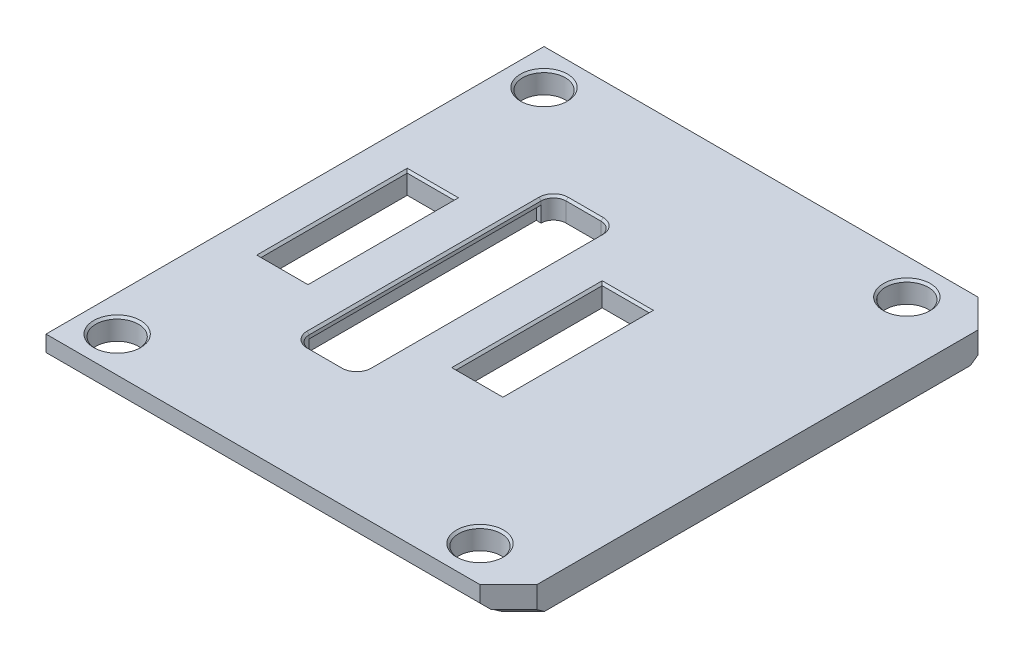
from build123d import *

# Parameters (mm, degrees)
SKETCH21_R          = 3
SKETCH21_W          = 6.6
SKETCH21_H          = 20.55
BOSS_EXTRUDE3_DEPTH = 3
BOSS_EXTRUDE2_DEPTH = 0.8
CUT_EXTRUDE1_DEPTH  = 2.2
CUT_EXTRUDE2_DEPTH  = 1
CHAMFER1_SIZE       = 0.3
CHAMFER2_SIZE       = 0.75


with BuildPart() as part:
    # Sketch21 → Boss-Extrude3 (new body)
    with BuildSketch(Plane(origin=(0, 0, 0), x_dir=(1, 0, 0), z_dir=(0, 1, 0))):
        Polygon((38.5, 35), (-22.5, 35), (-22.5, -35), (38.5, -35), (42.5, -31), (42.5, 31), align=None)
        with Locations((-17.5, 30)):
            Circle(SKETCH21_R, mode=Mode.SUBTRACT)
        with Locations((-17.5, -30)):
            Circle(SKETCH21_R, mode=Mode.SUBTRACT)
        with Locations((33.5, -30)):
            Circle(SKETCH21_R, mode=Mode.SUBTRACT)
        with Locations((33.5, 30)):
            Circle(SKETCH21_R, mode=Mode.SUBTRACT)
        with Locations((-13.7, 0)):
            Rectangle(SKETCH21_W, SKETCH21_H, mode=Mode.SUBTRACT)
        with BuildLine():
            Line((-4.21, 16.3), (-4.21, -16.3))
            ThreePointArc((-4.21, -16.3), (-3.697436867, -17.537436867), (-2.46, -18.05))
            Line((-2.46, -18.05), (2.46, -18.05))
            ThreePointArc((2.46, -18.05), (3.697436867, -17.537436867), (4.21, -16.3))
            Line((4.21, -16.3), (4.21, 16.3))
            ThreePointArc((4.21, 16.3), (3.697436867, 17.537436867), (2.46, 18.05))
            Line((2.46, 18.05), (-2.46, 18.05))
            ThreePointArc((-2.46, 18.05), (-3.697436867, 17.537436867), (-4.21, 16.3))
        make_face(mode=Mode.SUBTRACT)
        with Locations((13.7, 0)):
            Rectangle(SKETCH21_W, SKETCH21_H, mode=Mode.SUBTRACT)
    extrude(amount=BOSS_EXTRUDE3_DEPTH)

    # Sketch28 → Boss-Extrude2 (add)
    with BuildSketch(Plane.XZ):
        Polygon((39.5, 34), (39.5, -34), (42.5, -31), (42.5, 31), align=None)
    extrude(amount=BOSS_EXTRUDE2_DEPTH)

    # Sketch29 → Cut-Extrude1 (cut)
    with BuildSketch(Plane.XZ):
        Polygon((-4.21, 16.3), (-4.875, 16.3), (-4.875, -16.3), (-4.21, -16.3), (4.21, -16.3), (4.875, -16.3), (4.875, 16.3), (4.21, 16.3), align=None)
    extrude(amount=-CUT_EXTRUDE1_DEPTH, mode=Mode.SUBTRACT)

    # Sketch30 → Cut-Extrude2 (cut)
    # profile 1 of 4: a face of its own
    with BuildSketch(Plane.XZ):
        Polygon((30, -5.584415584), (30, -6.623376623), (23.194805195, -6.623376623), (30, -8.858766234), (30, -9.790584416), (23.194805195, -12.025974026), (30, -12.025974026), (30, -13.064935065), (22, -13.064935065), (22, -11.439935065), (28.668831169, -9.329545455), (22, -7.209415584), (22, -5.584415584), align=None)
    # profile 2 of 4: a face of its own
    with BuildSketch(Plane.XZ):
        with BuildLine():
            add(Edge.make_bspline(
                [(30.103896104, -1.798701299), (30.103067309, -1.895623244), (30.101458149, -2.083803562), (30.077120757, -2.356806977), (30.043441513, -2.612684332), (29.990720477, -2.849454628), (29.92681865, -3.069556735), (29.84494459, -3.270560491), (29.751676383, -3.4562646), (29.640184851, -3.621871579), (29.516615752, -3.772075178), (29.375879847, -3.901668661), (29.221972567, -4.015692158), (29.052257996, -4.109156913), (28.868514081, -4.186592109), (28.670085387, -4.243928609), (28.457107647, -4.285605452), (28.309709631, -4.297462408), (28.233766234, -4.303571429)],
                knots=[0, 0, 0, 0, 1.318794478, 2.560526035, 3.728243692, 4.829167506, 5.859211314, 6.844017696, 7.77958115, 8.682536498, 9.55583357, 10.420985288, 11.279874663, 12.156984126, 13.05163966, 13.988564904, 14.963654886, 16, 16, 16, 16], degree=3))
            Line((28.233766234, -4.303571429), (28.233766234, -3.26461039))
            add(Edge.make_bspline(
                [(28.233766234, -3.26461039), (28.276082816, -3.263564761), (28.357947694, -3.261541907), (28.476134337, -3.240166384), (28.586751637, -3.212672627), (28.688349357, -3.17036585), (28.783864525, -3.121500377), (28.868666466, -3.055998852), (28.946860594, -2.982137003), (29.015350514, -2.895594265), (29.078413582, -2.799861025), (29.128391442, -2.689971645), (29.17548457, -2.57144951), (29.209220227, -2.440779669), (29.240159157, -2.300318747), (29.257500765, -2.147495072), (29.271994968, -1.984042329), (29.272478757, -1.871250975), (29.272727273, -1.813311688)],
                knots=[0, 0, 0, 0, 1.000573209, 1.935690443, 2.836843993, 3.693268586, 4.535782358, 5.368499125, 6.220215677, 7.076544447, 7.975601122, 8.926814499, 9.928453325, 10.991382637, 12.117004715, 13.331014315, 14.628980654, 16, 16, 16, 16], degree=3))
            add(Edge.make_bspline(
                [(29.272727273, -1.813311688), (29.272477286, -1.761323175), (29.271992064, -1.660413873), (29.25754424, -1.51369465), (29.239472891, -1.376258483), (29.21132631, -1.248275466), (29.176555316, -1.130075024), (29.131923796, -1.021611339), (29.080501402, -0.922166793), (29.001941506, -0.806296479), (28.891278773, -0.682718379), (28.73659228, -0.572587187), (28.562614518, -0.50468464), (28.440535545, -0.497283039), (28.378246753, -0.493506494)],
                knots=[0, 0, 0, 0, 1.049722362, 2.037502948, 2.975957546, 3.848689641, 4.682196446, 5.461765277, 6.214820971, 6.939488855, 8.285974658, 9.541612251, 10.745648019, 12, 12, 12, 12], degree=3))
            add(Edge.make_bspline(
                [(28.378246753, -0.493506494), (28.346763417, -0.494183282), (28.285509435, -0.495500043), (28.198094752, -0.513038493), (28.116989153, -0.536078954), (28.043895516, -0.573277175), (27.978132386, -0.620152847), (27.91781187, -0.675968403), (27.867975971, -0.743948686), (27.822461309, -0.822779364), (27.783044583, -0.918968765), (27.736245211, -1.032239323), (27.690729471, -1.168941517), (27.640192756, -1.326342557), (27.586743359, -1.505529733), (27.52981461, -1.706135721), (27.472099938, -1.929578583), (27.410484723, -2.167825675), (27.348547139, -2.408916775), (27.281606559, -2.638344652), (27.213843382, -2.85068402), (27.144538665, -3.046605107), (27.071027512, -3.224150567), (26.999273376, -3.386230737), (26.921988655, -3.529162978), (26.844897165, -3.658210405), (26.757806858, -3.771639817), (26.655650322, -3.868805026), (26.538272332, -3.949974022), (26.405573224, -4.015399248), (26.259022178, -4.067101625), (26.096859779, -4.104654298), (25.919870357, -4.124614358), (25.797123614, -4.128080852), (25.733766234, -4.12987013)],
                knots=[0, 0, 0, 0, 0.609469888, 1.185784659, 1.72354831, 2.239788445, 2.766795736, 3.28643782, 3.825837257, 4.394650866, 5.047817349, 5.838989728, 6.771546224, 7.840191231, 9.04536596, 10.397473415, 11.883969141, 13.520573579, 15.169980156, 16.710930355, 18.154580726, 19.492276644, 20.739482987, 21.88068629, 22.927624582, 23.888735019, 24.79347993, 25.691627909, 26.611521855, 27.550140283, 28.552530272, 29.619112255, 30.771072804, 32, 32, 32, 32], degree=3))
            add(Edge.make_bspline(
                [(25.733766234, -4.12987013), (25.67520802, -4.127970482), (25.560134212, -4.12423745), (25.391367911, -4.095537471), (25.230466456, -4.050698077), (25.077097455, -3.986528081), (24.932327589, -3.902583067), (24.793763605, -3.802331737), (24.665049855, -3.681655436), (24.543482, -3.546039193), (24.43312437, -3.394260688), (24.339684079, -3.227132066), (24.257615927, -3.049505201), (24.190985373, -2.859321562), (24.141623211, -2.656271887), (24.103560771, -2.442230454), (24.083220864, -2.215216877), (24.079718791, -2.060100694), (24.077922078, -1.980519481)],
                knots=[0, 0, 0, 0, 0.925490325, 1.81869781, 2.698985002, 3.561843198, 4.439506826, 5.339694674, 6.260029024, 7.223537863, 8.216200057, 9.220155366, 10.24621711, 11.306974059, 12.400590692, 13.547020494, 14.741516967, 16, 16, 16, 16], degree=3))
            add(Edge.make_bspline(
                [(24.077922078, -1.980519481), (24.079100785, -1.889033894), (24.081391296, -1.711255453), (24.100967879, -1.45323672), (24.133116756, -1.211952726), (24.17768197, -0.988210503), (24.236413566, -0.781944584), (24.307185153, -0.593035368), (24.392098481, -0.421208329), (24.489260392, -0.266089492), (24.600165531, -0.128414151), (24.72493983, -0.008947344), (24.86185203, 0.094298865), (25.012592849, 0.179129373), (25.17622274, 0.24610088), (25.353001809, 0.293934263), (25.542097394, 0.327525812), (25.673013023, 0.334222491), (25.74025974, 0.337662338)],
                knots=[0, 0, 0, 0, 1.35942475, 2.641688414, 3.842675212, 4.97503988, 6.028837698, 7.026524857, 7.968775207, 8.872346758, 9.741443809, 10.588878301, 11.433254833, 12.283089724, 13.152223979, 14.05361, 15.000208458, 16, 16, 16, 16], degree=3))
            Line((25.74025974, 0.337662338), (25.74025974, -0.701298701))
            add(Edge.make_bspline(
                [(25.74025974, -0.701298701), (25.674721832, -0.708715551), (25.549076856, -0.722934647), (25.375375364, -0.789794963), (25.22801032, -0.891278982), (25.108112126, -1.029254824), (25.017480494, -1.20236831), (24.95378105, -1.408593969), (24.915339674, -1.647931329), (24.911256881, -1.818566714), (24.909090909, -1.909090909)],
                knots=[0, 0, 0, 0, 0.958885329, 1.838312007, 2.683388096, 3.544636038, 4.476874501, 5.512704297, 6.680458674, 8, 8, 8, 8], degree=3))
            add(Edge.make_bspline(
                [(24.909090909, -1.909090909), (24.910895743, -1.990953805), (24.914357274, -2.147960509), (24.950990134, -2.372453696), (25.008423519, -2.575331214), (25.076523787, -2.727354018), (25.141975259, -2.834516311), (25.197828471, -2.902415345), (25.256998255, -2.962751797), (25.325503304, -3.006899846), (25.395422474, -3.046527148), (25.472769579, -3.071306954), (25.554938786, -3.088887883), (25.61190975, -3.090222262), (25.641233766, -3.090909091)],
                knots=[0, 0, 0, 0, 1.898886608, 3.641917703, 5.263913708, 6.781775949, 7.492829293, 8.171637923, 8.820129793, 9.443813489, 10.056392137, 10.680075833, 11.320610447, 12, 12, 12, 12], degree=3))
            add(Edge.make_bspline(
                [(25.641233766, -3.090909091), (25.693601745, -3.088173991), (25.793343993, -3.082964606), (25.932521067, -3.032755637), (26.046460672, -2.946847813), (26.120477608, -2.847186421), (26.16971367, -2.744863761), (26.211505197, -2.642238609), (26.256566207, -2.515362815), (26.304827388, -2.364194696), (26.357408524, -2.188599575), (26.409102043, -1.987553747), (26.469062821, -1.762972788), (26.527292162, -1.519674479), (26.590317686, -1.2725332), (26.656464534, -1.035158817), (26.725715485, -0.814577671), (26.79891335, -0.611735187), (26.873636009, -0.425204125), (26.951004783, -0.255596696), (27.03015641, -0.102152272), (27.113523202, 0.035276924), (27.205414194, 0.157824135), (27.315001132, 0.261070929), (27.438169167, 0.349818461), (27.576625602, 0.423191195), (27.731509238, 0.478381448), (27.901145757, 0.516112898), (28.08529053, 0.541358551), (28.213113542, 0.544058296), (28.279220779, 0.545454545)],
                knots=[0, 0, 0, 0, 0.886876726, 1.689182582, 2.470212093, 3.276978007, 3.770089089, 4.396329915, 5.157818963, 6.055717916, 7.090729244, 8.269771542, 9.580232216, 11.037716353, 12.51750611, 13.910932755, 15.221554488, 16.442288017, 17.571848501, 18.632682187, 19.606715272, 20.501836021, 21.360120455, 22.198499933, 23.047686038, 23.931415603, 24.849906235, 25.830634081, 26.878051879, 28, 28, 28, 28], degree=3))
            add(Edge.make_bspline(
                [(28.279220779, 0.545454545), (28.34371882, 0.543630808), (28.470156379, 0.540055678), (28.655638898, 0.510463378), (28.832279264, 0.459141376), (29.001301578, 0.390285703), (29.160557988, 0.298734214), (29.312612514, 0.189780286), (29.455421384, 0.059180933), (29.587891688, -0.090437305), (29.709455888, -0.255056432), (29.815732766, -0.434994432), (29.904732119, -0.628858396), (29.978152624, -0.836386007), (30.034513409, -1.057599571), (30.074835203, -1.292625486), (30.099493407, -1.541138559), (30.10240589, -1.711522119), (30.103896104, -1.798701299)],
                knots=[0, 0, 0, 0, 0.930697296, 1.824475469, 2.702134557, 3.581182897, 4.452177757, 5.347490549, 6.276448989, 7.239081344, 8.228006388, 9.226020669, 10.250015029, 11.302452558, 12.399371731, 13.540990107, 14.741812496, 16, 16, 16, 16], degree=3))
        make_face()
    # profile 3 of 4: a face of its own
    with BuildSketch(Plane.XZ):
        with BuildLine():
            add(Edge.make_bspline(
                [(25.647727273, 5.178571429), (25.663868926, 5.237404481), (25.69557779, 5.352976864), (25.762492791, 5.516984929), (25.835929277, 5.672140779), (25.923226831, 5.81521402), (26.018845928, 5.950031986), (26.127864162, 6.072742713), (26.247280239, 6.185841594), (26.376872604, 6.28761882), (26.515090001, 6.378286676), (26.659549059, 6.45859736), (26.81114494, 6.524396891), (26.967502898, 6.580747863), (27.130251704, 6.622014072), (27.298222331, 6.653609379), (27.472566559, 6.671258081), (27.590872115, 6.673954721), (27.650974026, 6.675324675)],
                knots=[0, 0, 0, 0, 1.080664403, 2.122870637, 3.135513598, 4.121071696, 5.090243488, 6.062260214, 7.025955744, 8.002884062, 8.979435442, 9.954147163, 10.929236533, 11.906306165, 12.897591187, 13.902432714, 14.934388144, 16, 16, 16, 16], degree=3))
            add(Edge.make_bspline(
                [(27.650974026, 6.675324675), (27.739854939, 6.673405907), (27.914040031, 6.669645585), (28.168383993, 6.632372222), (28.410389853, 6.575012395), (28.639068653, 6.490870724), (28.855708519, 6.385874537), (29.05907064, 6.255790351), (29.249847074, 6.102603889), (29.42507564, 5.926349967), (29.583344894, 5.733286649), (29.72476204, 5.528675355), (29.840884526, 5.310068065), (29.937692278, 5.081523022), (30.012255802, 4.841667341), (30.066187197, 4.590758052), (30.096758443, 4.328136897), (30.101488106, 4.149427376), (30.103896104, 4.058441558)],
                knots=[0, 0, 0, 0, 1.061234395, 2.079762722, 3.064490561, 4.027783754, 4.984830282, 5.935369269, 6.905666123, 7.902249684, 8.898896153, 9.885150834, 10.868604494, 11.850803598, 12.846610963, 13.864831468, 14.91292835, 16, 16, 16, 16], degree=3))
            add(Edge.make_bspline(
                [(30.103896104, 4.058441558), (30.102120341, 3.967449783), (30.09864379, 3.789308073), (30.068592889, 3.528175859), (30.020586594, 3.279884364), (29.952721368, 3.044086446), (29.862379017, 2.822994362), (29.75516052, 2.612920408), (29.62669014, 2.416941052), (29.480317734, 2.234963781), (29.318861636, 2.068833521), (29.140729889, 1.924531884), (28.951634941, 1.798827965), (28.750498448, 1.691806048), (28.535196167, 1.607499779), (28.307020597, 1.545008992), (28.066977572, 1.500037912), (27.902241026, 1.487114062), (27.818181818, 1.480519481)],
                knots=[0, 0, 0, 0, 1.135749397, 2.223545359, 3.276913024, 4.29032888, 5.281452121, 6.254425173, 7.230723357, 8.20144198, 9.166501487, 10.11721784, 11.05787061, 11.997770945, 12.956281165, 13.938150449, 14.947911418, 16, 16, 16, 16], degree=3))
            Line((27.818181818, 1.480519481), (27.818181818, 2.519480519))
            add(Edge.make_bspline(
                [(27.818181818, 2.519480519), (27.866934669, 2.520835885), (27.963143634, 2.523510565), (28.105064693, 2.541513361), (28.241668711, 2.572034218), (28.373112317, 2.616670569), (28.499069526, 2.673408824), (28.620465875, 2.741435382), (28.73407753, 2.824561436), (28.84506768, 2.915325519), (28.944792, 3.020897323), (29.034003892, 3.136442101), (29.106641276, 3.265108353), (29.168814459, 3.402711229), (29.216292352, 3.551970086), (29.247102771, 3.711704313), (29.269926845, 3.881387443), (29.271775916, 3.998293047), (29.272727273, 4.058441558)],
                knots=[0, 0, 0, 0, 0.982384219, 1.938638799, 2.877766169, 3.798479997, 4.73074491, 5.658598904, 6.596649402, 7.564215146, 8.543750727, 9.516464438, 10.498424915, 11.513726023, 12.555216713, 13.645896338, 14.788802012, 16, 16, 16, 16], degree=3))
            add(Edge.make_bspline(
                [(29.272727273, 4.058441558), (29.271636863, 4.116945008), (29.269498994, 4.23164753), (29.24815687, 4.399143646), (29.21226241, 4.557159819), (29.163716623, 4.706530984), (29.10004518, 4.846138452), (29.023692475, 4.977375255), (28.931567821, 5.098397045), (28.826506652, 5.209266545), (28.711259097, 5.31059354), (28.586417318, 5.397889369), (28.453226039, 5.472113523), (28.31198031, 5.531551029), (28.162672232, 5.579291148), (28.005084397, 5.613291253), (27.838695906, 5.63273205), (27.72515911, 5.635136407), (27.667207792, 5.636363636)],
                knots=[0, 0, 0, 0, 1.107013682, 2.170423479, 3.189239045, 4.170707987, 5.137962914, 6.088366183, 7.038935031, 8.00992507, 8.975442867, 9.938784847, 10.887917706, 11.856310932, 12.834621176, 13.851220186, 14.903222337, 16, 16, 16, 16], degree=3))
            add(Edge.make_bspline(
                [(27.667207792, 5.636363636), (27.608148375, 5.635365734), (27.493412764, 5.633427093), (27.326739082, 5.611254972), (27.170529463, 5.578063998), (27.024533613, 5.529978012), (26.887759663, 5.47146586), (26.763378155, 5.395007086), (26.648492661, 5.306948012), (26.544440534, 5.204803721), (26.453539854, 5.088360148), (26.373759138, 4.96098952), (26.304436544, 4.821727597), (26.250060086, 4.668936898), (26.208377006, 4.504094117), (26.177167244, 4.32783609), (26.159766001, 4.138878407), (26.157178483, 4.008692527), (26.155844156, 3.941558442)],
                knots=[0, 0, 0, 0, 1.094523671, 2.126347478, 3.112462429, 4.051770496, 4.972837835, 5.864293945, 6.751447308, 7.652621225, 8.560030944, 9.48437223, 10.435769975, 11.438843206, 12.48539564, 13.585791557, 14.755044136, 16, 16, 16, 16], degree=3))
            Line((26.155844156, 3.941558442), (26.155844156, 3.558441558))
            Line((26.155844156, 3.558441558), (25.324675325, 3.558441558))
            Line((25.324675325, 3.558441558), (25.324675325, 3.784090909))
            add(Edge.make_bspline(
                [(25.324675325, 3.784090909), (25.323981736, 3.842041052), (25.322636957, 3.954398948), (25.305370906, 4.117560066), (25.280812359, 4.269895069), (25.242946936, 4.411154572), (25.194905289, 4.540750961), (25.135489264, 4.65900637), (25.067703214, 4.767179103), (24.987470673, 4.863807736), (24.89592461, 4.948341697), (24.794320442, 5.022443365), (24.681641532, 5.083833355), (24.558696063, 5.134574994), (24.424753455, 5.173482763), (24.280011907, 5.199863333), (24.125511196, 5.219134389), (24.019004063, 5.220220981), (23.964285714, 5.220779221)],
                knots=[0, 0, 0, 0, 1.224683085, 2.374503454, 3.465438828, 4.483957385, 5.46148884, 6.382482867, 7.277528178, 8.154997256, 9.029327969, 9.905826849, 10.807066319, 11.735562612, 12.713094066, 13.749764922, 14.84393519, 16, 16, 16, 16], degree=3))
            add(Edge.make_bspline(
                [(23.964285714, 5.220779221), (23.915519624, 5.220125134), (23.820942567, 5.218856598), (23.683886842, 5.201030767), (23.555242862, 5.178255703), (23.4353673, 5.142312275), (23.325248056, 5.094335192), (23.221497555, 5.040211096), (23.128774024, 4.972224668), (23.043551507, 4.896265006), (22.969760877, 4.809634867), (22.902851442, 4.716778724), (22.850561986, 4.612967625), (22.803798169, 4.502916159), (22.77110931, 4.383065774), (22.743949408, 4.25592629), (22.730135556, 4.119893558), (22.728240078, 4.02653921), (22.727272727, 3.978896104)],
                knots=[0, 0, 0, 0, 1.171660605, 2.27232101, 3.318572352, 4.31058758, 5.272450672, 6.203912609, 7.117482204, 8.029475319, 8.942581526, 9.848615055, 10.773968381, 11.730802205, 12.719141549, 13.755148827, 14.854347071, 16, 16, 16, 16], degree=3))
            add(Edge.make_bspline(
                [(22.727272727, 3.978896104), (22.728169319, 3.929618155), (22.729917405, 3.833540939), (22.744555482, 3.694002328), (22.769087414, 3.5626543), (22.802515691, 3.439615316), (22.846726417, 3.324919729), (22.900385422, 3.218712089), (22.964121486, 3.120809885), (23.036962256, 3.030843605), (23.121502148, 2.951065235), (23.213464033, 2.877330272), (23.317032583, 2.814189325), (23.429525822, 2.758849084), (23.55183696, 2.711828354), (23.683818649, 2.673238614), (23.82524868, 2.641647554), (23.92356413, 2.629573704), (23.974025974, 2.623376623)],
                knots=[0, 0, 0, 0, 1.146609889, 2.235545268, 3.260562954, 4.253516318, 5.198347118, 6.116360883, 7.017549724, 7.912469503, 8.803126044, 9.717678205, 10.650770472, 11.619470255, 12.632113028, 13.6960019, 14.817439237, 16, 16, 16, 16], degree=3))
            Line((23.974025974, 2.623376623), (23.974025974, 1.584415584))
            add(Edge.make_bspline(
                [(23.974025974, 1.584415584), (23.891536316, 1.595491761), (23.730820825, 1.617071596), (23.49908682, 1.671599586), (23.28182109, 1.740680654), (23.080104832, 1.828456116), (22.89367264, 1.933054673), (22.721638858, 2.053585402), (22.565393924, 2.192468558), (22.424444691, 2.346784403), (22.298928011, 2.514014638), (22.192377977, 2.693287602), (22.101003684, 2.880575148), (22.025479621, 3.077057378), (21.967752565, 3.283162054), (21.924992811, 3.498525193), (21.900674721, 3.723461312), (21.897646323, 3.876565989), (21.896103896, 3.954545455)],
                knots=[0, 0, 0, 0, 1.142169937, 2.225302016, 3.263813611, 4.268665131, 5.239997227, 6.194388434, 7.14704291, 8.104119823, 9.059580441, 10.012669396, 10.963003292, 11.917828189, 12.898576775, 13.898140725, 14.929478407, 16, 16, 16, 16], degree=3))
            add(Edge.make_bspline(
                [(21.896103896, 3.954545455), (21.898182041, 4.040103983), (21.90224287, 4.207290909), (21.927863443, 4.451775437), (21.972866291, 4.683438788), (22.038407666, 4.900911692), (22.119068899, 5.106173132), (22.22071004, 5.296671169), (22.339120987, 5.47455687), (22.475881631, 5.636692266), (22.626153392, 5.782324628), (22.788343431, 5.909984701), (22.960499597, 6.01996472), (23.145280228, 6.107301905), (23.339473739, 6.175971252), (23.544049781, 6.224562302), (23.758857417, 6.254390013), (23.905746386, 6.257935465), (23.980519481, 6.25974026)],
                knots=[0, 0, 0, 0, 1.174172572, 2.294409512, 3.369223252, 4.407712349, 5.407484268, 6.390793334, 7.365002839, 8.334843795, 9.295916777, 10.231873001, 11.163103634, 12.093149119, 13.030283017, 13.984907703, 14.974227358, 16, 16, 16, 16], degree=3))
            add(Edge.make_bspline(
                [(23.980519481, 6.25974026), (24.065203257, 6.256841309), (24.233394758, 6.251083667), (24.48111319, 6.197810302), (24.721971786, 6.114744319), (24.953735645, 5.998129344), (25.17061421, 5.848339759), (25.361787661, 5.659744915), (25.524408366, 5.43501246), (25.605917562, 5.265514507), (25.647727273, 5.178571429)],
                knots=[0, 0, 0, 0, 0.963351205, 1.913323811, 2.872209819, 3.858873871, 4.859014299, 5.861316868, 6.902973797, 8, 8, 8, 8], degree=3))
        make_face()
    # profile 4 of 4: a face of its own
    with BuildSketch(Plane.XZ):
        with BuildLine():
            add(Edge.make_bspline(
                [(24.878246753, 8.961038961), (24.814187466, 9.018718223), (24.688796852, 9.131620481), (24.52623408, 9.319626512), (24.38902696, 9.516006238), (24.274055052, 9.719122635), (24.185259096, 9.932124103), (24.124260188, 10.154220452), (24.085370567, 10.385004196), (24.080429628, 10.542051167), (24.077922078, 10.621753247)],
                knots=[0, 0, 0, 0, 1.085250411, 2.124285525, 3.122966424, 4.099740098, 5.059495047, 6.022248179, 6.996281616, 8, 8, 8, 8], degree=3))
            add(Edge.make_bspline(
                [(24.077922078, 10.621753247), (24.080388406, 10.71442069), (24.085197844, 10.895125927), (24.123411532, 11.157861469), (24.184306732, 11.404870872), (24.272255, 11.635752436), (24.387153957, 11.849110858), (24.524114245, 12.048005833), (24.688142408, 12.229328525), (24.877058745, 12.392596956), (25.086654972, 12.538797969), (25.315305287, 12.664833525), (25.559504609, 12.774982728), (25.822560693, 12.861856011), (26.102716801, 12.930025074), (26.400708473, 12.978028939), (26.715845271, 13.007721006), (26.931750621, 13.011204737), (27.042207792, 13.012987013)],
                knots=[0, 0, 0, 0, 1.032558834, 2.013531219, 2.952724632, 3.863440268, 4.759334089, 5.647806176, 6.548963813, 7.476698465, 8.425450168, 9.392113565, 10.383030705, 11.407311388, 12.475256329, 13.593801989, 14.76898917, 16, 16, 16, 16], degree=3))
            add(Edge.make_bspline(
                [(27.042207792, 13.012987013), (27.157541132, 13.010763865), (27.382188592, 13.006433594), (27.709535495, 12.974051549), (28.017782216, 12.918849126), (28.307815796, 12.842667109), (28.580203904, 12.746008442), (28.833597649, 12.625035021), (29.068200596, 12.482093506), (29.282094588, 12.31769338), (29.474911402, 12.138602071), (29.643383348, 11.946244921), (29.785901829, 11.742265117), (29.901915152, 11.525799081), (29.993700364, 11.298532687), (30.0563313, 11.058394628), (30.096796644, 10.808192264), (30.101508048, 10.637064002), (30.103896104, 10.550324675)],
                knots=[0, 0, 0, 0, 1.255961248, 2.446374192, 3.578096896, 4.663065679, 5.708848904, 6.721082169, 7.715645011, 8.695165174, 9.654207175, 10.577283402, 11.474815653, 12.358130333, 13.246756847, 14.137354944, 15.05588606, 16, 16, 16, 16], degree=3))
            add(Edge.make_bspline(
                [(30.103896104, 10.550324675), (30.101957507, 10.473402044), (30.098135909, 10.321762811), (30.06994442, 10.09904847), (30.024642656, 9.885538268), (29.961678515, 9.681233999), (29.877748249, 9.487089156), (29.776994728, 9.301656094), (29.658183542, 9.124227831), (29.565007665, 9.015871412), (29.517857143, 8.961038961)],
                knots=[0, 0, 0, 0, 1.064402764, 2.098279994, 3.101513528, 4.082158303, 5.051759688, 6.023614418, 6.999874063, 8, 8, 8, 8], degree=3))
            Line((29.517857143, 8.961038961), (32.285714286, 8.961038961))
            Line((32.285714286, 8.961038961), (32.285714286, 7.922077922))
            Line((32.285714286, 7.922077922), (24.181818182, 7.922077922))
            Line((24.181818182, 7.922077922), (24.181818182, 8.961038961))
            Line((24.181818182, 8.961038961), (24.878246753, 8.961038961))
        make_face()
        with BuildLine():
            add(Edge.make_bspline(
                [(28.582792208, 8.961038961), (28.638068094, 9.016806457), (28.746272219, 9.125972921), (28.88604868, 9.30468271), (29.005525826, 9.488624463), (29.10353432, 9.678758798), (29.178838914, 9.875397967), (29.232421931, 10.077816102), (29.266023104, 10.286763726), (29.270477616, 10.428446258), (29.272727273, 10.5)],
                knots=[0, 0, 0, 0, 1.085707992, 2.125304366, 3.132607823, 4.117140125, 5.079411284, 6.040195589, 7.010242569, 8, 8, 8, 8], degree=3))
            add(Edge.make_bspline(
                [(29.272727273, 10.5), (29.271564887, 10.555333141), (29.269292802, 10.663491349), (29.239839848, 10.820741082), (29.196497459, 10.96900301), (29.136257851, 11.109490038), (29.055236931, 11.23925618), (28.959450301, 11.36231131), (28.844022134, 11.474748696), (28.712202831, 11.578371652), (28.563994598, 11.673419787), (28.397122683, 11.754505361), (28.212848364, 11.821562178), (28.013017105, 11.879403423), (27.794752168, 11.919663171), (27.5604292, 11.953303498), (27.308137994, 11.969921857), (27.134757703, 11.972630718), (27.045454545, 11.974025974)],
                knots=[0, 0, 0, 0, 0.883090077, 1.726152498, 2.546968976, 3.348612605, 4.159853212, 4.985030933, 5.834983544, 6.727674538, 7.660828743, 8.643132597, 9.685597177, 10.791445765, 11.963314957, 13.229053737, 14.572765964, 16, 16, 16, 16], degree=3))
            add(Edge.make_bspline(
                [(27.045454545, 11.974025974), (26.960488256, 11.972475312), (26.795809545, 11.969469872), (26.556459939, 11.955037872), (26.334057605, 11.922691005), (26.126274149, 11.883838663), (25.935303572, 11.829227501), (25.757782142, 11.767878791), (25.598800519, 11.688161553), (25.452904693, 11.601577669), (25.325039242, 11.502172732), (25.21216834, 11.39471845), (25.119935221, 11.274953005), (25.042443311, 11.14727479), (24.981985433, 11.010401495), (24.939903278, 10.863480785), (24.913104526, 10.707694614), (24.91044575, 10.600220469), (24.909090909, 10.545454545)],
                knots=[0, 0, 0, 0, 1.408584611, 2.730069766, 3.970578609, 5.131496849, 6.230442265, 7.260312358, 8.239039861, 9.17271741, 10.067908288, 10.917833178, 11.748516327, 12.565283383, 13.388525032, 14.22012764, 15.093025089, 16, 16, 16, 16], degree=3))
            add(Edge.make_bspline(
                [(24.909090909, 10.545454545), (24.911597622, 10.473740048), (24.91662789, 10.329829249), (24.967176055, 10.118412528), (25.041627812, 9.910177473), (25.150533213, 9.709114776), (25.288800898, 9.511868337), (25.4585467, 9.321890573), (25.656752375, 9.134221833), (25.805680198, 9.020282822), (25.883116883, 8.961038961)],
                knots=[0, 0, 0, 0, 0.889314606, 1.784603949, 2.686204335, 3.630395475, 4.614970347, 5.672211878, 6.789640565, 8, 8, 8, 8], degree=3))
            Line((25.883116883, 8.961038961), (28.582792208, 8.961038961))
        make_face(mode=Mode.SUBTRACT)
    extrude(amount=-CUT_EXTRUDE2_DEPTH, mode=Mode.SUBTRACT)

    # Chamfer1
    chamfer1_edges = [part.edges().sort_by_distance(p)[0] for p in [
        (30.5, 3, 30),
        (-20.5, 3, 30),
        (-20.5, 3, -30),
        (30.5, 3, -30),
        (17, 3, 0),
        (13.7, 3, -10.275),
        (10.4, 3, 0),
        (13.7, 3, 10.275),
        (-13.7, 3, 10.275),
        (-17, 3, 0),
        (-10.4, 3, 0),
        (-13.7, 3, -10.275),
        (0, 3, 18.05),
        (3.697436867, 3, 17.537436867),
        (-3.697436867, 3, 17.537436867),
        (4.21, 3, 0),
        (-4.21, 3, 0),
        (3.697436867, 3, -17.537436867),
        (-3.697436867, 3, -17.537436867),
        (0, 3, -18.05),
    ]]
    chamfer(chamfer1_edges, length=CHAMFER1_SIZE)

    # Chamfer2
    chamfer2_edges = [part.edges().sort_by_distance(p)[0] for p in [
        (41, -0.8, -32.5),
        (41, -0.8, 32.5),
        (8, 0, -35),
        (8, 0, 35),
        (-22.5, 0, 0),
    ]]
    chamfer(chamfer2_edges, length=CHAMFER2_SIZE)


solid = part.part
